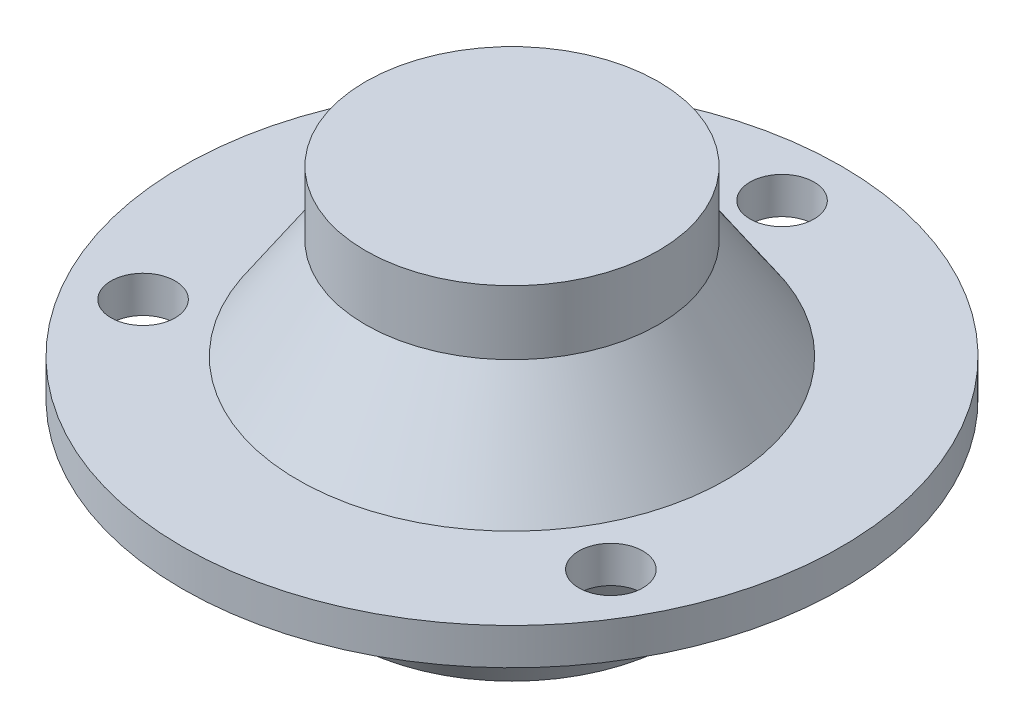
from build123d import *

# Parameters (mm, degrees)
ESQUISSE3_R                  = 1.75
ENL_V_MAT_EXTRU_1_DEPTH      = 29.583211856
R_P_TITION_CIRCULAIRE1_COUNT = 3


with BuildPart() as part:
    # Esquisse1 → Révolution1 (revolve)
    with BuildSketch(Plane.XY):
        Polygon((0, 0), (0, 9), (8, 9), (8, 5.5), (11.69, 0), (18, 0), (18, -2), (12.5, -2), (9, -9), (0, -9), align=None)
    revolve(axis=Axis((0, 0, 0), (0, 1, 0)))

    # Esquisse2 → Révolution2 (revolve)
    with BuildSketch(Plane.XY):
        with BuildLine():
            Line((0, 7), (0, -13))
            ThreePointArc((0, -13), (10, -3), (0, 7))
        make_face()
    revolve(axis=Axis((0, 7, 0), (0, -1, 0)))

    # Esquisse3 → Enlèv. mat.-Extru.1 (cut, through all)
    with BuildSketch(Plane(origin=(0, 0, 0), x_dir=(1, 0, 0), z_dir=(0, 1, 0))):
        with Locations((0, 14.75)):
            Circle(ESQUISSE3_R)
    enl_v_mat_extru_1 = extrude(amount=-ENL_V_MAT_EXTRU_1_DEPTH, mode=Mode.SUBTRACT)

    # Répétition circulaire1: Enlèv. mat.-Extru.1 ×3 about axis
    r_p_tition_circulaire1_axis = Axis((0, -14.1, 0), (0, 1, 0))
    for i in range(1, R_P_TITION_CIRCULAIRE1_COUNT):
        add(enl_v_mat_extru_1.rotate(r_p_tition_circulaire1_axis, i * 360 / R_P_TITION_CIRCULAIRE1_COUNT), mode=Mode.SUBTRACT)


solid = part.part
